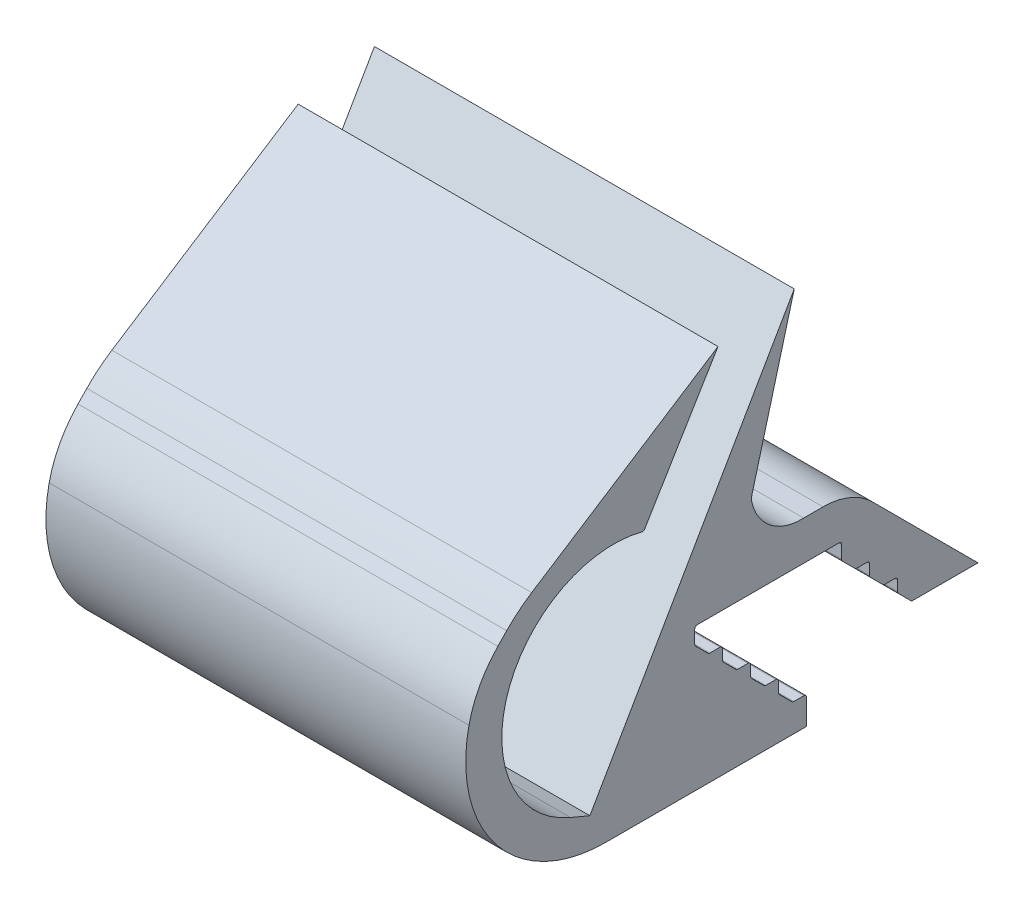
from build123d import *

# Parameters (mm, degrees)
BOSS_EXTRUDE1_DEPTH     = 100
CUT_EXTRUDE1_DEPTH      = 25
CUT_EXTRUDE1_DEPTH_BACK = 23


with BuildPart() as part:
    # Sketch1 → Boss-Extrude1 (new body)
    with BuildSketch(Plane(origin=(0, 0, 0), x_dir=(0, 0, -1), z_dir=(1, 0, 0))):
        with BuildLine():
            Line((-25.742274507, -27.603839777), (-25.742274507, -25.803839777))
            ThreePointArc((-25.742274507, -25.803839777), (-25.800853151, -25.66241842), (-25.942274507, -25.603839777))
            Line((-25.942274507, -25.603839777), (-26.659431795, -25.603839777))
            ThreePointArc((-26.659431795, -25.603839777), (-26.735968481, -25.588615683), (-26.800853151, -25.545261133))
            Line((-26.800853151, -25.545261133), (-27.683695863, -24.66241842))
            ThreePointArc((-27.683695863, -24.66241842), (-27.727050414, -24.597533751), (-27.742274507, -24.520997064))
            Line((-27.742274507, -24.520997064), (-27.742274507, -23.803839777))
            ThreePointArc((-27.742274507, -23.803839777), (-27.800853151, -23.66241842), (-27.942274507, -23.603839777))
            Line((-27.942274507, -23.603839777), (-28.659431795, -23.603839777))
            ThreePointArc((-28.659431795, -23.603839777), (-28.735968481, -23.588615683), (-28.800853151, -23.545261133))
            Line((-28.800853151, -23.545261133), (-29.683695863, -22.66241842))
            ThreePointArc((-29.683695863, -22.66241842), (-29.727050414, -22.597533751), (-29.742274507, -22.520997064))
            Line((-29.742274507, -22.520997064), (-29.742274507, -21.803839777))
            ThreePointArc((-29.742274507, -21.803839777), (-29.800853151, -21.66241842), (-29.942274507, -21.603839777))
            Line((-29.942274507, -21.603839777), (-30.659431795, -21.603839777))
            ThreePointArc((-30.659431795, -21.603839777), (-30.735968481, -21.588615683), (-30.800853151, -21.545261133))
            Line((-30.800853151, -21.545261133), (-31.683695863, -20.66241842))
            ThreePointArc((-31.683695863, -20.66241842), (-31.727050414, -20.597533751), (-31.742274507, -20.520997064))
            Line((-31.742274507, -20.520997064), (-31.742274507, -19.803839777))
            ThreePointArc((-31.742274507, -19.803839777), (-31.800853151, -19.66241842), (-31.942274507, -19.603839777))
            Line((-31.942274507, -19.603839777), (-32.659431795, -19.603839777))
            ThreePointArc((-32.659431795, -19.603839777), (-32.735968481, -19.588615683), (-32.800853151, -19.545261133))
            Line((-32.800853151, -19.545261133), (-33.683695863, -18.66241842))
            ThreePointArc((-33.683695863, -18.66241842), (-33.727050414, -18.597533751), (-33.742274507, -18.520997064))
            Line((-33.742274507, -18.520997064), (-33.742274507, -17.603839777))
            ThreePointArc((-33.742274507, -17.603839777), (-33.683695863, -17.46241842), (-33.542274507, -17.403839777))
            Line((-33.542274507, -17.403839777), (-23.442274507, -17.403839777))
            ThreePointArc((-23.442274507, -17.403839777), (-23.300853151, -17.46241842), (-23.242274507, -17.603839777))
            Line((-23.242274507, -17.603839777), (-23.242274507, -18.520997064))
            ThreePointArc((-23.242274507, -18.520997064), (-23.227050414, -18.597533751), (-23.183695863, -18.66241842))
            Line((-23.183695863, -18.66241842), (-22.300853151, -19.545261133))
            ThreePointArc((-22.300853151, -19.545261133), (-22.235968481, -19.588615683), (-22.159431795, -19.603839777))
            Line((-22.159431795, -19.603839777), (-21.442274507, -19.603839777))
            ThreePointArc((-21.442274507, -19.603839777), (-21.300853151, -19.66241842), (-21.242274507, -19.803839777))
            Line((-21.242274507, -19.803839777), (-21.242274507, -20.520997064))
            ThreePointArc((-21.242274507, -20.520997064), (-21.227050414, -20.597533751), (-21.183695863, -20.66241842))
            Line((-21.183695863, -20.66241842), (-20.300853151, -21.545261133))
            ThreePointArc((-20.300853151, -21.545261133), (-20.235968481, -21.588615683), (-20.159431795, -21.603839777))
            Line((-20.159431795, -21.603839777), (-19.442118142, -21.603839777))
            ThreePointArc((-19.442118142, -21.603839777), (-19.300696786, -21.66241842), (-19.242118142, -21.803839777))
            Line((-19.242118142, -21.803839777), (-19.242118142, -22.520623569))
            ThreePointArc((-19.242118142, -22.520623569), (-19.226894049, -22.597160256), (-19.183539499, -22.662044925))
            Line((-19.183539499, -22.662044925), (-18.242118142, -23.603466282))
            Line((-18.242118142, -23.603466282), (-17.742118142, -23.603466282))
            Line((-17.742118142, -23.603466282), (-13.499477455, -23.603466282))
            Line((-13.499477455, -23.603466282), (-21.035011361, -16.067932376))
            ThreePointArc((-21.035011361, -16.067932376), (-22.657128105, -14.984068619), (-24.570545267, -14.603466282))
            Line((-24.570545267, -14.603466282), (-25.960279372, -14.603466282))
            ThreePointArc((-25.960279372, -14.603466282), (-28.324188996, -13.859549098), (-29.658362326, -11.771137499))
            ThreePointArc((-29.658362326, -11.771137499), (-29.682182939, -11.531427852), (-29.647989066, -11.292976777))
            Line((-29.647989066, -11.292976777), (-26.628869488, -0.086805783))
            Line((-26.628869488, -0.086805783), (-28.360920296, -3.086805783))
            Line((-28.360920296, -3.086805783), (-41.233903642, -25.383466984))
            Line((-41.233903642, -25.383466984), (-42.615547882, -24.805037605))
            ThreePointArc((-42.615547882, -24.805037605), (-47.10930963, -14.877001433), (-37.531576616, -9.678268204))
            ThreePointArc((-37.531576616, -9.678268204), (-37.404269433, -9.668981846), (-37.308507446, -9.584583996))
            Line((-37.308507446, -9.584583996), (-32.078617814, -0.926149435))
            Line((-32.078617814, -0.926149435), (-45.393459966, -9.499644714))
            ThreePointArc((-45.393459966, -9.499644714), (-46.329728955, -10.180367196), (-47.181058303, -10.964727481))
            Line((-47.181058303, -10.964727481), (-47.811097829, -11.616550026))
            ThreePointArc((-47.811097829, -11.616550026), (-49.110536056, -13.39823645), (-49.874169518, -15.467006653))
            ThreePointArc((-49.874169518, -15.467006653), (-47.89514388, -23.874073774), (-40.105139668, -27.603839777))
            Line((-40.105139668, -27.603839777), (-25.742274507, -27.603839777))
        make_face()
    extrude(amount=BOSS_EXTRUDE1_DEPTH)

    # Sketch2 → Cut-Extrude1 (cut, two sides: drawn at the far end of the back side and taken through both)
    with BuildSketch(Plane(origin=(76.97885739, -34.993991596, 31.933978), x_dir=(1, 0, 0), z_dir=(0, 0, 1)).offset(-CUT_EXTRUDE1_DEPTH_BACK)):
        Polygon((-46.97885739, 36.842742805), (-6.97885739, 36.842742805), (-6.97885739, -2.226993345), (-46.97885739, -2.226993345), (-84.546864986, -2.226993345), (-84.546864986, 36.842742805), align=None)
    extrude(amount=CUT_EXTRUDE1_DEPTH + CUT_EXTRUDE1_DEPTH_BACK, mode=Mode.SUBTRACT)


solid = part.part
